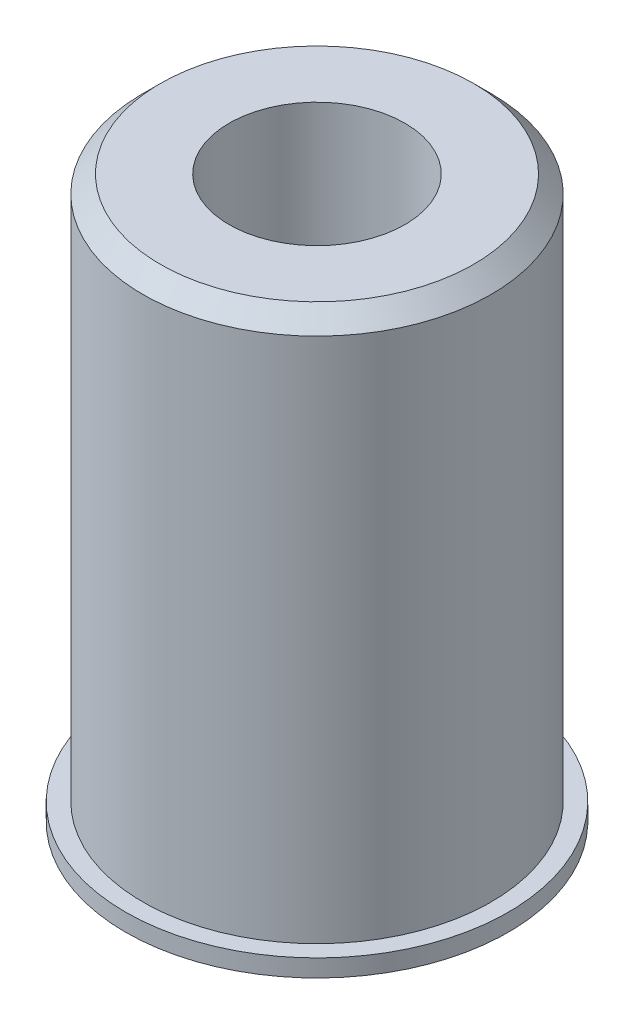
from build123d import *


with BuildPart() as part:
    # Sketch1 → Revolve1 (revolve)
    with BuildSketch(Plane.XY):
        Polygon((-10, 0), (-11, 0), (-11, -1), (-8.25, -1), (-8.25, 23.725), (-5.05, 23.725), (-5.05, 31.225), (-9, 31.225), (-10, 30.225), align=None)
    revolve(axis=Axis((0, 0, 0), (0, 1, 0)))


solid = part.part
